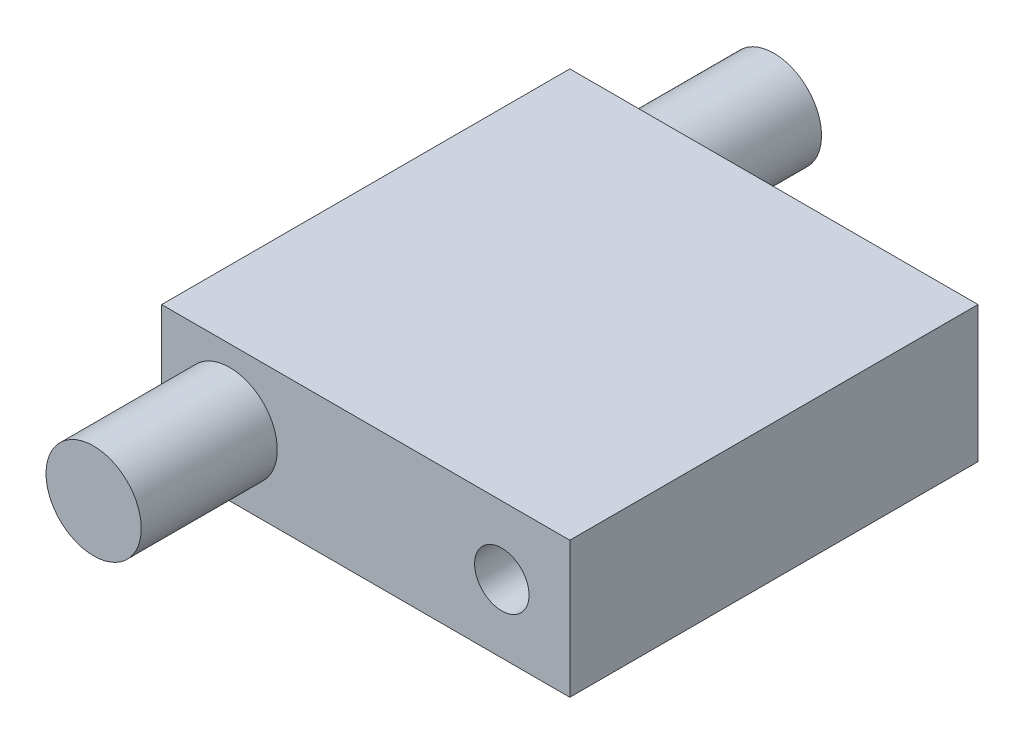
from build123d import *

# Parameters (mm, degrees)
SKETCH1_W               = 600
SKETCH1_H               = 200
BOSS_EXTRUDE1_DEPTH     = 600
CUT_EXTRUDE1_DEPTH      = 40
CUT_EXTRUDE1_DEPTH_BACK = 600
SKETCH2_R               = 40
SKETCH3_R               = 70
BOSS_EXTRUDE2_DEPTH     = 200
BOSS_EXTRUDE3_START     = 200
SKETCH4_R               = 70
BOSS_EXTRUDE3_DEPTH     = 200


with BuildPart() as part:
    # Sketch1 → Boss-Extrude1 (new body)
    with BuildSketch(Plane.XY):
        Rectangle(SKETCH1_W, SKETCH1_H)
    extrude(amount=BOSS_EXTRUDE1_DEPTH)

    # Sketch2 → Cut-Extrude1 (cut, two sides: drawn at the far end of the back side and taken through both)
    with BuildSketch(Plane.XY.offset(600).offset(-CUT_EXTRUDE1_DEPTH_BACK)):
        with Locations(Location((200, 0, 0), (0, 0, 180))):
            Circle(SKETCH2_R)
    extrude(amount=CUT_EXTRUDE1_DEPTH + CUT_EXTRUDE1_DEPTH_BACK, mode=Mode.SUBTRACT)

    # Sketch3 → Boss-Extrude2 (add)
    with BuildSketch(Plane.XY.offset(600)):
        with Locations(Location((-200, 0, 0), (0, 0, 180))):
            Circle(SKETCH3_R)
    extrude(amount=BOSS_EXTRUDE2_DEPTH)

    # Sketch4 → Boss-Extrude3 (add)
    with BuildSketch(Plane(origin=(0, 0, 0), x_dir=(-1, 0, 0), z_dir=(0, 0, -1)).offset(BOSS_EXTRUDE3_START)):
        with Locations((200, 0)):
            Circle(SKETCH4_R)
    extrude(amount=-BOSS_EXTRUDE3_DEPTH)


solid = part.part
